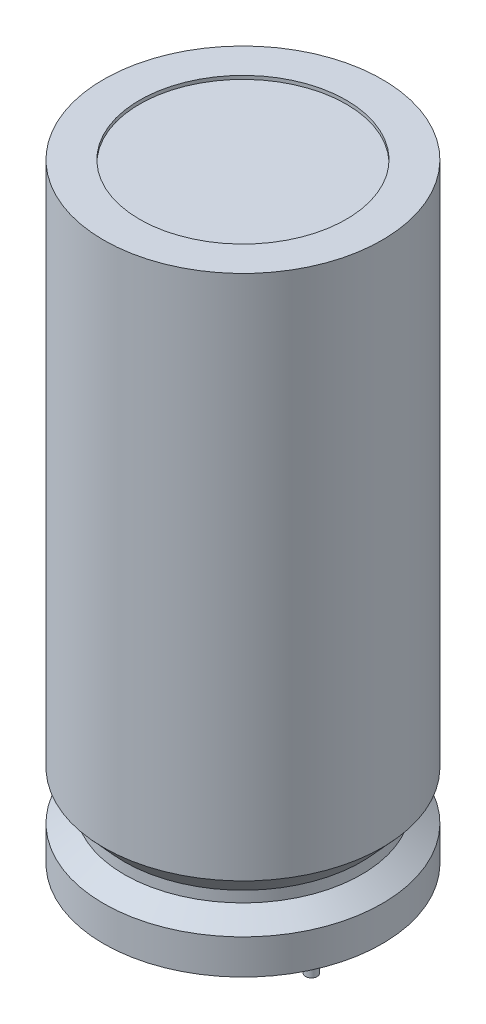
from build123d import *

# Parameters (mm, degrees)
SKETCH_2_R          = 0.337317786
SKETCH_2_R_2        = 0.332910614
EXTRUDE_1_DEPTH     = 3.5
SKETCH_3_R          = 5.93451457
CUT_EXTRUDE_1_DEPTH = 0.2
SKETCH_4_R          = 5.530592895
CUT_EXTRUDE_2_DEPTH = 0.2


with BuildPart() as part:
    # 草图1 → 旋转1 (revolve)
    with BuildSketch(Plane.XY, mode=Mode.PRIVATE) as revolve_1_sk:
        Polygon((0, 0), (-8, 0), (-8, 2), (-6.809071375, 2.84756708), (-6.809071375, 3.478415102), (-8, 4.78410207), (-8, 35), (0, 35), align=None)
    revolve(revolve_1_sk.sketch.rotate(Axis((0, 10.427265959, 0), (0, -1, 0)), 270), axis=Axis((0, 10.427265959, 0), (0, -1, 0)))

    # 草图2 → 凸台-拉伸1 (add)
    with BuildSketch(Plane.XZ):
        with Locations(Location((-3.585921992, 0, 0), (0, 0, 270))):
            Circle(SKETCH_2_R)
        with Locations(Location((3.929204485, 0, 0), (0, 0, 270))):
            Circle(SKETCH_2_R_2)
    extrude(amount=EXTRUDE_1_DEPTH)

    # 草图3 → 切除-拉伸1 (cut)
    with BuildSketch(Plane(origin=(0, 35, 0), x_dir=(1, 0, 0), z_dir=(0, 1, 0))):
        with Locations(Location((0, 0, 0), (0, 0, 270))):
            Circle(SKETCH_3_R)
    extrude(amount=-CUT_EXTRUDE_1_DEPTH, mode=Mode.SUBTRACT)

    # 草图4 → 切除-拉伸2 (cut)
    with BuildSketch(Plane.XZ):
        with Locations(Location((0, 0, 0), (0, 0, 270))):
            Circle(SKETCH_4_R)
    extrude(amount=-CUT_EXTRUDE_2_DEPTH, mode=Mode.SUBTRACT)


with BuildPart() as cut_extrude_2_piece_1:
    # of the separate pieces the step leaves, piece 1, a body of its own (cut_extrude_2_pieces)
    add(part.part.solids().sort_by_distance((0, 0, 8))[0])


with BuildPart() as cut_extrude_2_piece_2:
    # of the separate pieces the step leaves, piece 2, a body of its own (cut_extrude_2_pieces)
    add(part.part.solids().sort_by_distance((-3.585921992, 0, -0.337317786))[0])


with BuildPart() as cut_extrude_2_piece_3:
    # of the separate pieces the step leaves, piece 3, a body of its own (cut_extrude_2_pieces)
    add(part.part.solids().sort_by_distance((3.929204485, 0, -0.332910614))[0])


solid = Compound([cut_extrude_2_piece_1.part, cut_extrude_2_piece_2.part, cut_extrude_2_piece_3.part])
